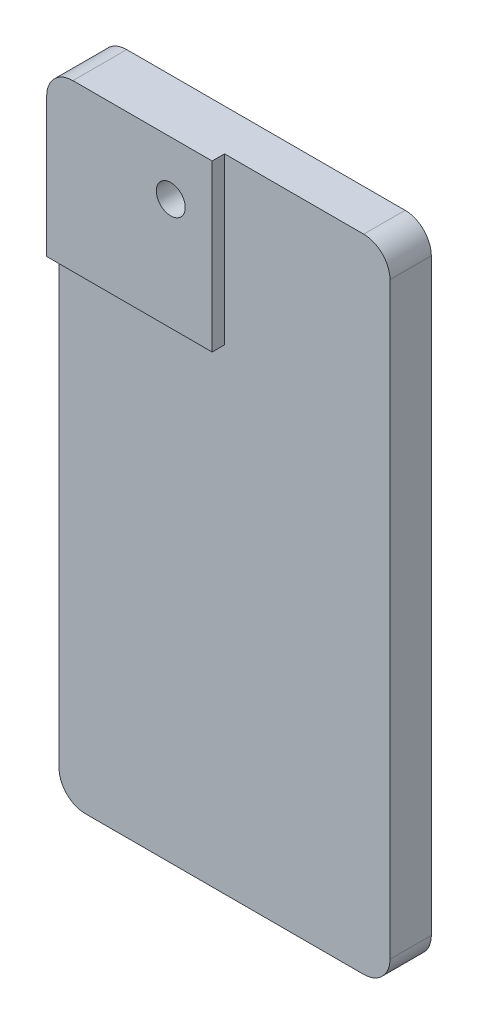
from build123d import *

# Parameters (mm, degrees)
SKETCH1_W           = 80
SKETCH1_H           = 155
BOSS_EXTRUDE1_DEPTH = 5
SKETCH2_W           = 40
SKETCH2_H           = 40
BOSS_EXTRUDE2_DEPTH = 3
SKETCH3_R           = 3.5
CUT_EXTRUDE1_DEPTH  = 89.177378051
FILLET1_R           = 6.35


with BuildPart() as part:
    # Sketch1 → Boss-Extrude1 (new, symmetric)
    with BuildSketch(Plane.XY):
        Rectangle(SKETCH1_W, SKETCH1_H)
    extrude(amount=BOSS_EXTRUDE1_DEPTH, both=True)

    # Sketch2 → Boss-Extrude2 (add)
    with BuildSketch(Plane.XY.offset(5)):
        with Locations((-20, 57.5)):
            Rectangle(SKETCH2_W, SKETCH2_H)
    extrude(amount=BOSS_EXTRUDE2_DEPTH)

    # Sketch3 → Cut-Extrude1 (cut, through all)
    with BuildSketch(Plane.XY.offset(8)):
        with Locations((-10, 64.5)):
            Circle(SKETCH3_R)
    extrude(amount=-CUT_EXTRUDE1_DEPTH, mode=Mode.SUBTRACT)

    # Fillet1
    fillet1_edges = [part.edges().sort_by_distance(p)[0] for p in [
        (40, -77.5, 0),
        (-40, -77.5, 0),
        (-40, 77.5, 1.5),
        (40, 77.5, 0),
    ]]
    fillet(fillet1_edges, radius=FILLET1_R)


solid = part.part
